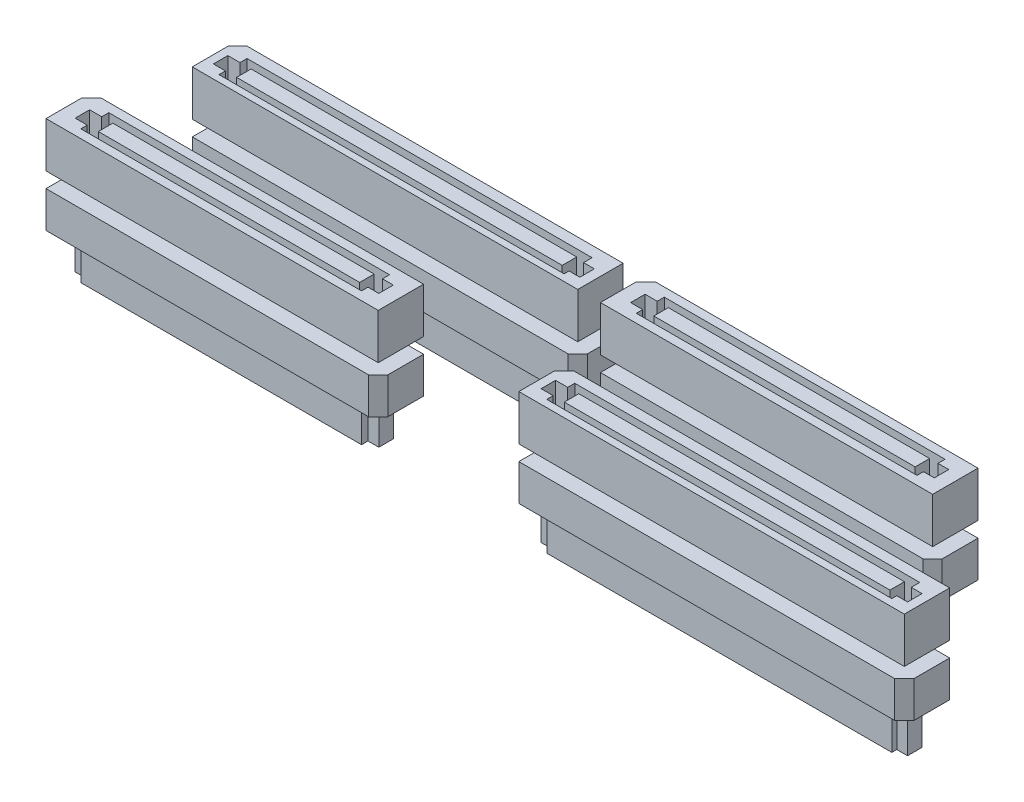
from build123d import *

# Parameters (mm, degrees)
SV_DEPTH           = 5
SV_2_DEPTH         = 5
SV_3_DEPTH         = 5
SV_4_DEPTH         = 5
SKETCH3_W          = 28.811718275
SKETCH3_H          = 1.597828601
SKETCH3_W_2        = 35.897762959
SKETCH3_W_3        = 35.897762958
CUT_EXTRUDE1_DEPTH = 4
SV4_A_DEPTH        = 4
SV4_A_2_DEPTH      = 4
SV4_A_3_DEPTH      = 4
SV4_A_4_DEPTH      = 4
SKETCH7_W          = 35.897762958
SKETCH7_H          = 1.597828601
SV4_B_DEPTH        = 4
SKETCH7_W_2        = 28.811718275
SV4_B_2_DEPTH      = 4
SKETCH7_W_3        = 35.897762959
SV4_B_3_DEPTH      = 4
SV4_B_4_DEPTH      = 4


with BuildPart() as part:
    # Sketch1 → SV (new body)
    with BuildSketch(Plane(origin=(0, 0, 0), x_dir=(1, 0, 0), z_dir=(0, 1, 0))):
        Polygon((55.811, 9.5), (97.25, 9.5), (97.25, 5.56), (97.25, 4.5), (96.19, 4.5), (54.75, 4.5), (54.75, 8.439), align=None)
    extrude(amount=SV_DEPTH)


with BuildPart() as body_2:
    # Sketch1 → SV 2 (new body)
    with BuildSketch(Plane(origin=(0, 0, 0), x_dir=(1, 0, 0), z_dir=(0, 1, 0))):
        Polygon((3.686, 9.5), (39.25, 9.5), (39.25, 5.555), (39.25, 4.5), (38.195, 4.5), (2.625, 4.5), (2.625, 8.439), align=None)
    extrude(amount=SV_2_DEPTH)


with BuildPart() as body_3:
    # Sketch1 → SV 3 (new body)
    with BuildSketch(Plane(origin=(0, 0, 0), x_dir=(1, 0, 0), z_dir=(0, 1, 0))):
        Polygon((51.811, 22.5), (87.375, 22.5), (87.375, 18.555), (87.375, 17.5), (86.32, 17.5), (50.75, 17.5), (50.75, 21.439), align=None)
    extrude(amount=SV_3_DEPTH)


with BuildPart() as body_4:
    # Sketch1 → SV 4 (new body)
    with BuildSketch(Plane(origin=(0, 0, 0), x_dir=(1, 0, 0), z_dir=(0, 1, 0))):
        Polygon((6.811, 22.5), (48.25, 22.5), (48.25, 18.56), (48.25, 17.5), (47.19, 17.5), (5.75, 17.5), (5.75, 21.439), align=None)
    extrude(amount=SV_4_DEPTH)


with BuildPart() as cut_extrude1_tool:
    # Sketch3 → Cut-Extrude1 (new body)
    # profile 1 of 4: a face of its own
    with BuildSketch(Plane(origin=(0, 5, 0), x_dir=(1, 0, 0), z_dir=(0, 1, 0))):
        Polygon((4.189336253, 7.745735487), (5.524337048, 7.745735487), (5.524337048, 8.524173538), (36.475691419, 8.524173538), (36.475691419, 7.745735487), (37.666991912, 7.745735487), (37.666991912, 6.147906886), (36.475691419, 6.147906886), (36.475691419, 5.438560322), (5.524337048, 5.438560322), (5.524337048, 6.147906886), (4.189336253, 6.147906886), align=None)
        with Locations((21.152985591, 6.946821187)):
            Rectangle(SKETCH3_W, SKETCH3_H, mode=Mode.SUBTRACT)
    # profile 2 of 4: a face of its own
    with BuildSketch(Plane(origin=(0, 5, 0), x_dir=(1, 0, 0), z_dir=(0, 1, 0))):
        Polygon((52.421116037, 20.753597434), (53.756116831, 20.753597434), (53.756116831, 21.532035485), (84.707471203, 21.532035485), (84.707471203, 20.753597434), (85.898771695, 20.753597434), (85.898771695, 19.155768833), (84.707471203, 19.155768833), (84.707471203, 18.446422269), (53.756116831, 18.446422269), (53.756116831, 19.155768833), (52.421116037, 19.155768833), align=None)
        with Locations((69.384765375, 19.954683133)):
            Rectangle(SKETCH3_W, SKETCH3_H, mode=Mode.SUBTRACT)
    # profile 3 of 4: a face of its own
    with BuildSketch(Plane(origin=(0, 5, 0), x_dir=(1, 0, 0), z_dir=(0, 1, 0))):
        Polygon((55.705906871, 7.599031898), (57.040907666, 7.599031898), (57.040907666, 8.377469948), (95.07830672, 8.377469948), (95.07830672, 7.437727621), (96.269607213, 7.437727621), (96.269607213, 5.83989902), (95.07830672, 5.83989902), (95.07830672, 5.291856733), (57.040907666, 5.291856733), (57.040907666, 6.001203297), (55.705906871, 6.001203297), align=None)
        with Locations((76.21257855, 6.800117597)):
            Rectangle(SKETCH3_W_2, SKETCH3_H, mode=Mode.SUBTRACT)
    # profile 4 of 4: a face of its own
    with BuildSketch(Plane(origin=(0, 5, 0), x_dir=(1, 0, 0), z_dir=(0, 1, 0))):
        Polygon((6.636601859, 20.53972103), (7.971602653, 20.53972103), (7.971602653, 21.318159081), (46.009001708, 21.318159081), (46.009001708, 20.378416754), (47.2003022, 20.378416754), (47.2003022, 18.780588153), (46.009001708, 18.780588153), (46.009001708, 18.232545866), (7.971602653, 18.232545866), (7.971602653, 18.941892429), (6.636601859, 18.941892429), align=None)
        with Locations((27.143273538, 19.74080673)):
            Rectangle(SKETCH3_W_3, SKETCH3_H, mode=Mode.SUBTRACT)
    extrude(amount=-CUT_EXTRUDE1_DEPTH)


with BuildPart() as part_1:
    add(part.part)

    # Cut-Extrude1: cut by cut_extrude1_tool
    add(cut_extrude1_tool.part, mode=Mode.SUBTRACT)


with BuildPart() as body_2_1:
    add(body_2.part)

    # Cut-Extrude1: cut by cut_extrude1_tool
    add(cut_extrude1_tool.part, mode=Mode.SUBTRACT)


with BuildPart() as body_3_1:
    add(body_3.part)

    # Cut-Extrude1: cut by cut_extrude1_tool
    add(cut_extrude1_tool.part, mode=Mode.SUBTRACT)


with BuildPart() as body_4_1:
    add(body_4.part)

    # Cut-Extrude1: cut by cut_extrude1_tool
    add(cut_extrude1_tool.part, mode=Mode.SUBTRACT)


with BuildPart() as body_5:
    # Sketch6 → SV4(a) (new body)
    with BuildSketch(Plane(origin=(0, -1.68656, 0), x_dir=(1, 0, 0), z_dir=(0, 1, 0))):
        Polygon((2.625, 4.5), (38.195, 4.5), (39.25, 5.555), (39.25, 9.5), (3.685, 9.5), (2.625, 9.5), (2.625, 8.44), align=None)
    extrude(amount=-SV4_A_DEPTH)


with BuildPart() as body_6:
    # Sketch6 → SV4_a 2 (new body)
    with BuildSketch(Plane(origin=(0, -1.68656, 0), x_dir=(1, 0, 0), z_dir=(0, 1, 0))):
        Polygon((48.25, 18.56191605), (47.18808395, 17.5), (5.75, 17.5), (5.75, 21.44), (5.75, 22.5), (6.81, 22.5), (48.25, 22.5), align=None)
    extrude(amount=-SV4_A_2_DEPTH)


with BuildPart() as body_7:
    # Sketch6 → SV4_a 3 (new body)
    with BuildSketch(Plane(origin=(0, -1.68656, 0), x_dir=(1, 0, 0), z_dir=(0, 1, 0))):
        Polygon((54.75, 4.5), (96.19, 4.5), (97.25, 5.56), (97.25, 9.5), (55.81, 9.5), (54.75, 9.5), (54.75, 8.44), align=None)
    extrude(amount=-SV4_A_3_DEPTH)


with BuildPart() as body_8:
    # Sketch6 → SV4_a 4 (new body)
    with BuildSketch(Plane(origin=(0, -1.68656, 0), x_dir=(1, 0, 0), z_dir=(0, 1, 0))):
        Polygon((50.75, 17.5), (86.32, 17.5), (87.375, 18.555), (87.375, 22.5), (51.805, 22.5), (50.75, 22.5), (50.75, 21.445), align=None)
    extrude(amount=-SV4_A_4_DEPTH)


with BuildPart() as body_9:
    # Sketch7 → SV4(b) (new body)
    with BuildSketch(Plane.XZ.offset(5.68656)):
        Polygon((7.971602653, -21.318159081), (7.971602653, -20.53972103), (6.636601859, -20.53972103), (6.636601859, -18.941892429), (7.971602653, -18.941892429), (7.971602653, -18.232545866), (46.009001708, -18.232545866), (46.009001708, -18.780588153), (47.2003022, -18.780588153), (47.2003022, -20.378416754), (46.009001708, -20.378416754), (46.009001708, -21.318159081), align=None)
        with Locations((27.143273538, -19.74080673)):
            Rectangle(SKETCH7_W, SKETCH7_H, mode=Mode.SUBTRACT)
    extrude(amount=SV4_B_DEPTH)


with BuildPart() as body_10:
    # Sketch7 → SV4_b 2 (new body)
    with BuildSketch(Plane.XZ.offset(5.68656)):
        Polygon((53.756116831, -21.532035485), (84.707471203, -21.532035485), (84.707471203, -20.753597434), (85.898771695, -20.753597434), (85.898771695, -19.155768833), (84.707471203, -19.155768833), (84.707471203, -18.446422269), (53.756116831, -18.446422269), (53.756116831, -19.155768833), (52.421116037, -19.155768833), (52.421116037, -20.753597434), (53.756116831, -20.753597434), align=None)
        with Locations((69.384765375, -19.954683133)):
            Rectangle(SKETCH7_W_2, SKETCH7_H, mode=Mode.SUBTRACT)
    extrude(amount=SV4_B_2_DEPTH)


with BuildPart() as body_11:
    # Sketch7 → SV4_b 3 (new body)
    with BuildSketch(Plane.XZ.offset(5.68656)):
        Polygon((57.040907666, -8.377469948), (57.040907666, -7.599031898), (55.705906871, -7.599031898), (55.705906871, -6.001203297), (57.040907666, -6.001203297), (57.040907666, -5.291856733), (95.07830672, -5.291856733), (95.07830672, -5.83989902), (96.269607213, -5.83989902), (96.269607213, -7.437727621), (95.07830672, -7.437727621), (95.07830672, -8.377469948), align=None)
        with Locations((76.21257855, -6.800117597)):
            Rectangle(SKETCH7_W_3, SKETCH7_H, mode=Mode.SUBTRACT)
    extrude(amount=SV4_B_3_DEPTH)


with BuildPart() as body_12:
    # Sketch7 → SV4_b 4 (new body)
    with BuildSketch(Plane.XZ.offset(5.68656)):
        Polygon((4.189336253, -6.147906886), (5.524337048, -6.147906886), (5.524337048, -5.438560322), (36.475691419, -5.438560322), (36.475691419, -6.147906886), (37.666991912, -6.147906886), (37.666991912, -7.745735487), (36.475691419, -7.745735487), (36.475691419, -8.524173538), (5.524337048, -8.524173538), (5.524337048, -7.745735487), (4.189336253, -7.745735487), align=None)
        with Locations((21.152985591, -6.946821187)):
            Rectangle(SKETCH7_W_2, SKETCH7_H, mode=Mode.SUBTRACT)
    extrude(amount=SV4_B_4_DEPTH)


solid = Compound([part_1.part, body_2_1.part, body_3_1.part, body_4_1.part, body_5.part, body_6.part, body_7.part, body_8.part, body_9.part, body_10.part, body_11.part, body_12.part])
